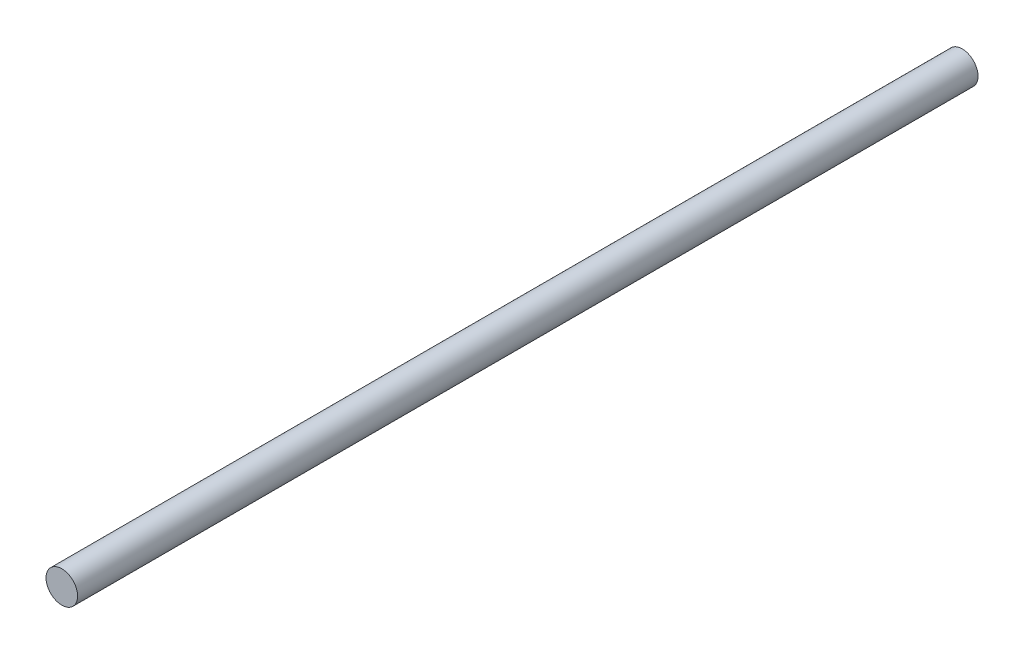
from build123d import *

# Parameters (mm, degrees)
SKETCH1_R           = 4
BOSS_EXTRUDE1_DEPTH = 228


with BuildPart() as part:
    # Sketch1 → Boss-Extrude1 (new body)
    with BuildSketch(Plane.XY):
        with Locations(Location((0, 0, 0), (0, 0, 180))):
            Circle(SKETCH1_R)
    extrude(amount=BOSS_EXTRUDE1_DEPTH)


solid = part.part
